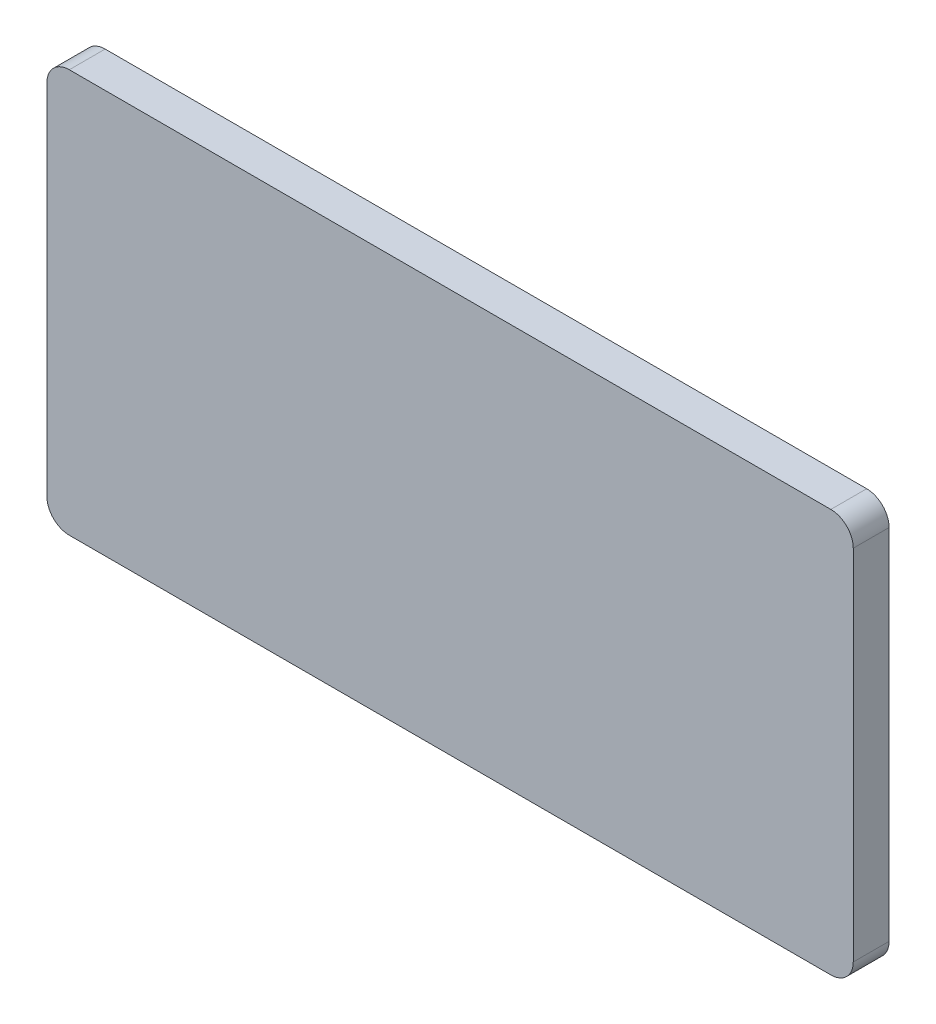
from build123d import *

# Parameters (mm, degrees)
SKETCH2_W           = 1800
SKETCH2_H           = 900
BOSS_EXTRUDE1_DEPTH = 80
FILLET1_R           = 50


with BuildPart() as part:
    # Sketch2 → Boss-Extrude1 (new body)
    with BuildSketch(Plane.XY):
        Rectangle(SKETCH2_W, SKETCH2_H)
    extrude(amount=BOSS_EXTRUDE1_DEPTH)

    # Fillet1
    fillet1_edges = [part.edges().sort_by_distance(p)[0] for p in [
        (900, -450, 40),
        (-900, -450, 40),
        (-900, 450, 40),
        (900, 450, 40),
    ]]
    fillet(fillet1_edges, radius=FILLET1_R)


solid = part.part
